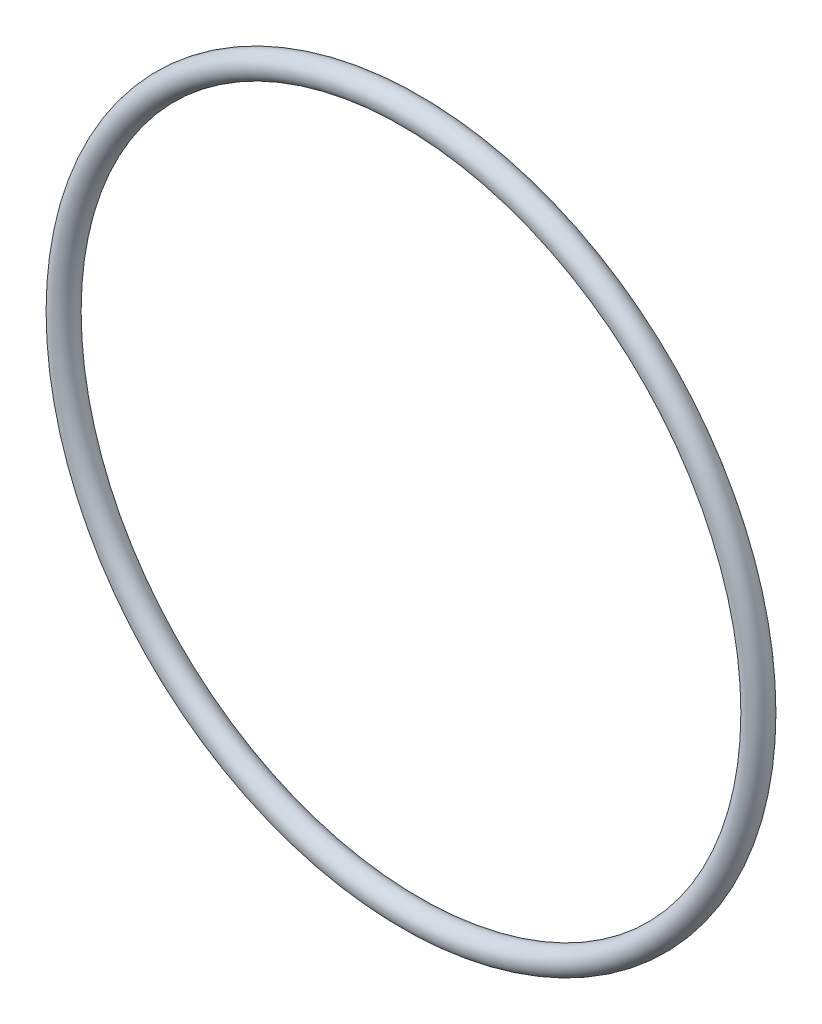
from build123d import *

# Parameters (mm, degrees)
SZKIC1_R = 1.5


with BuildPart() as part:
    # Szkic1 → Obrót1 (revolve)
    with BuildSketch(Plane(origin=(0, 0, 0), x_dir=(0, 0, -1), z_dir=(1, 0, 0))):
        with Locations((0, 42)):
            Circle(SZKIC1_R)
    revolve(axis=Axis((0, 0, 409.765498301), (0, 0, -1)))


solid = part.part
